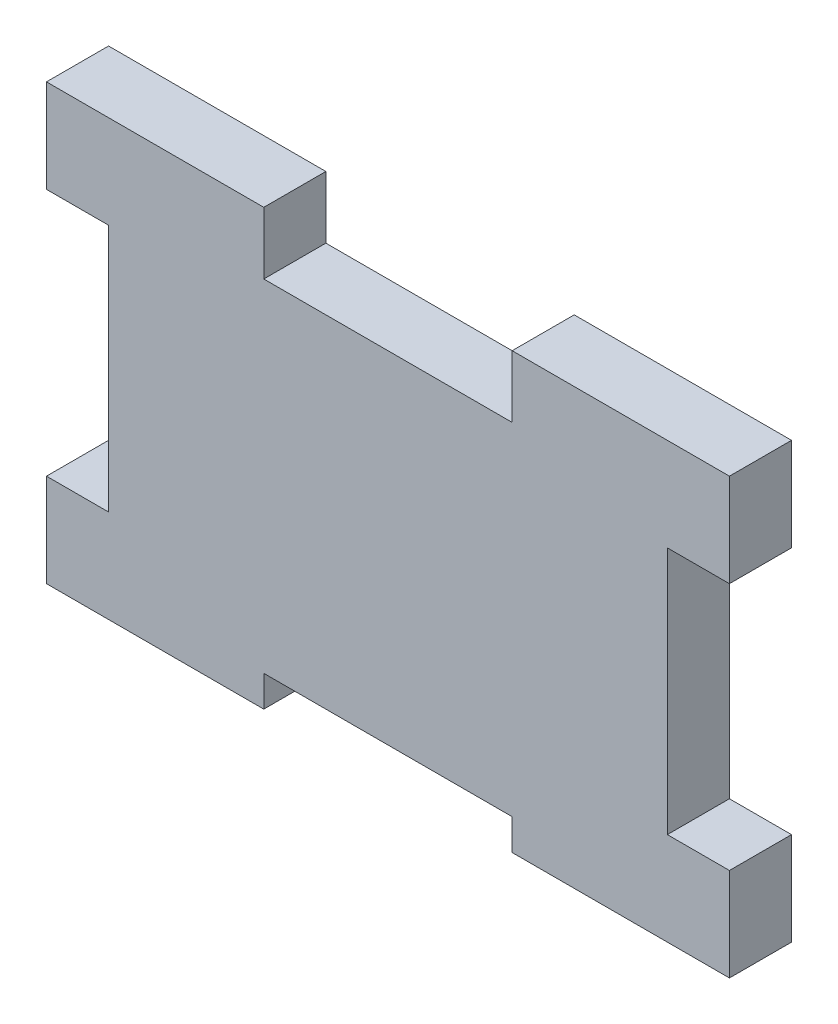
from build123d import *

# Parameters (mm, degrees)
BOSS_EXTRUDE1_DEPTH = 10


with BuildPart() as part:
    # Sketch2 → Boss-Extrude1 (new body)
    with BuildSketch(Plane.XY):
        Polygon((-10, 65), (-10, 50), (0, 50), (0, 10), (-10, 10), (-10, -5), (25, -5), (25, 0), (65, 0), (65, -5), (100, -5), (100, 10), (90, 10), (90, 50), (100, 50), (100, 65), (65, 65), (65, 55), (25, 55), (25, 65), align=None)
    extrude(amount=BOSS_EXTRUDE1_DEPTH)


solid = part.part
